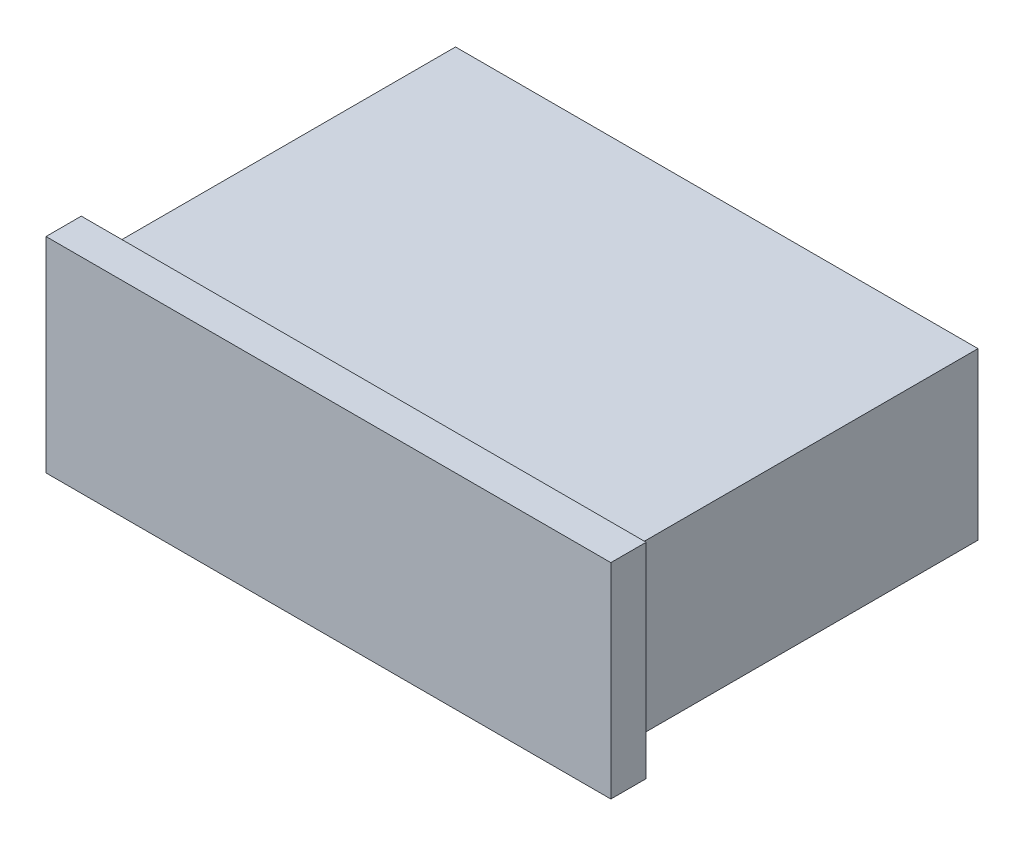
from build123d import *

# Parameters (mm, degrees)
SKETCH1_W           = 7.4
SKETCH1_H           = 2.35
BOSS_EXTRUDE1_DEPTH = 5
SKETCH2_W           = 8
SKETCH2_H           = 2.9
BOSS_EXTRUDE2_DEPTH = 0.5


with BuildPart() as part:
    # Sketch1 → Boss-Extrude1 (new body)
    with BuildSketch(Plane.XY):
        with Locations((3.7, 1.175)):
            Rectangle(SKETCH1_W, SKETCH1_H)
    extrude(amount=BOSS_EXTRUDE1_DEPTH)

    # Sketch2 → Boss-Extrude2 (add)
    with BuildSketch(Plane.XY.offset(5)):
        with Locations((3.7, 1.175)):
            Rectangle(SKETCH2_W, SKETCH2_H)
    extrude(amount=BOSS_EXTRUDE2_DEPTH)


solid = part.part
